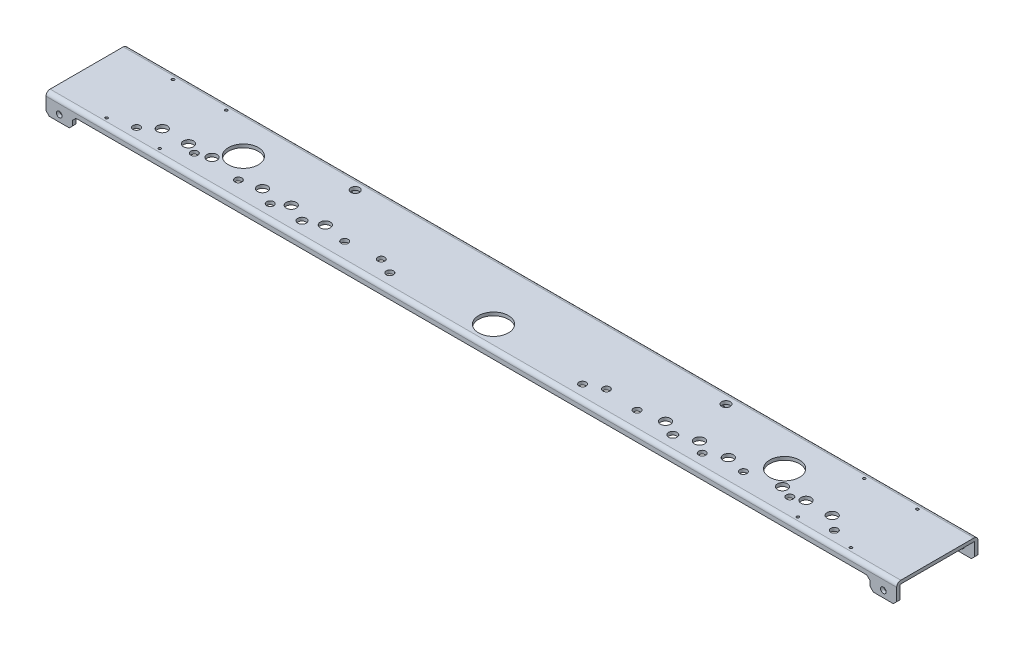
from build123d import *

# Parameters (mm, degrees)
SKETCH1_W                 = 812.8
SKETCH1_H                 = 77.724
BOSS_EXTRUDE1_DEPTH       = 19.05
SKETCH2_W                 = 71.374
SKETCH2_H                 = 15.875
CUT_EXTRUDE1_DEPTH        = 817.296745672
CUT_EXTRUDE2_REACH        = 818.662
SKETCH3_W                 = 762
SKETCH3_H                 = 11.1125
M8_CLEARANCE_HOLE1_D      = 9.652
M8_CLEARANCE_HOLE1_DEPTH  = 19.05
M2_CLEARANCE_HOLE1_D      = 2.54
M2_CLEARANCE_HOLE1_DEPTH  = 19.05
M25_CLEARANCE_HOLE1_D     = 28.575
M25_CLEARANCE_HOLE1_DEPTH = 19.05
M6_CLEARANCE_HOLE1_D      = 6.7564
M6_CLEARANCE_HOLE1_DEPTH  = 19.05
HOLE1_D                   = 8.128
HOLE1_DEPTH               = 19.05
M5_CLEARANCE_HOLE1_D      = 5.334
M5_CLEARANCE_HOLE1_DEPTH  = 3.175
M5_CLEARANCE_HOLE2_D      = 5.334
M5_CLEARANCE_HOLE2_DEPTH  = 77.724
CHAMFER1_SIZE             = 3.175
FILLET1_R                 = 0.762
FILLET2_R                 = 3.937


with BuildPart() as part:
    # Sketch1 → Boss-Extrude1 (new body)
    with BuildSketch(Plane.XZ.offset(15.875)):
        with Locations((406.4, -34.925)):
            Rectangle(SKETCH1_W, SKETCH1_H)
    extrude(amount=-BOSS_EXTRUDE1_DEPTH)

    # Sketch2 → Cut-Extrude1 (cut, through all)
    with BuildSketch(Plane.ZY):
        with Locations((-34.925, -7.9375)):
            Rectangle(SKETCH2_W, SKETCH2_H)
    extrude(amount=-CUT_EXTRUDE1_DEPTH, mode=Mode.SUBTRACT)

    # Sketch3 → Cut-Extrude2 (cut, up to next)
    with BuildSketch(Plane.XY.offset(3.937), mode=Mode.PRIVATE) as cut_extrude2_sk1:
        with Locations((406.4, -10.31875)):
            Rectangle(SKETCH3_W, SKETCH3_H)
    cut_extrude2_tool1 = extrude(cut_extrude2_sk1.sketch, amount=-CUT_EXTRUDE2_REACH, mode=Mode.PRIVATE) & part.part
    add(cut_extrude2_tool1.solids().sort_by_distance((406.4, -10.31875, 3.937))[0], mode=Mode.SUBTRACT)

    # M8 Clearance Hole1
    with Locations(Plane(origin=(0, 3.175, 0), x_dir=(1, 0, 0), z_dir=(0, 1, 0))):
        with Locations((568.924874752, 19.05), (601.438495912, 19.05), (628.947697627, 19.05), (243.875125248, 19.05), (211.361504088, 19.05), (183.852302373, 19.05), (678.944202666, 20.828), (701.450372003, 20.828), (726.460886343, 20.828), (133.855797334, 20.828), (111.349627997, 20.828), (86.339113657, 20.828)):
            Hole(M8_CLEARANCE_HOLE1_D / 2, depth=M8_CLEARANCE_HOLE1_DEPTH)

    # M2 Clearance Hole1
    with Locations(Plane(origin=(0, 3.175, 0), x_dir=(1, 0, 0), z_dir=(0, 1, 0))):
        with Locations((711.2, 3.175), (711.2, 66.675), (762, 3.175), (762, 66.675), (101.6, 3.175), (50.8, 3.175), (101.6, 66.675), (50.8, 66.675)):
            Hole(M2_CLEARANCE_HOLE1_D / 2, depth=M2_CLEARANCE_HOLE1_DEPTH)

    # M25 Clearance Hole1
    with Locations(Plane(origin=(0, 3.175, 0), x_dir=(1, 0, 0), z_dir=(0, 1, 0))):
        with Locations((664.970837168, 36.83), (147.829162832, 36.83), (406.4, 17.272)):
            Hole(M25_CLEARANCE_HOLE1_D / 2, depth=M25_CLEARANCE_HOLE1_DEPTH)

    # M6 Clearance Hole1
    with Locations(Plane(origin=(0, 3.175, 0), x_dir=(1, 0, 0), z_dir=(0, 1, 0))):
        with Locations((612.775, 10.287), (498.475, 10.287), (314.325, 10.287), (200.025, 10.287), (739.775, 9.525), (690.88, 15.875), (121.92, 15.875), (73.025, 9.525), (647.7, 14.732), (546.1, 14.732), (165.1, 14.732), (266.7, 14.732), (513.925467617, 17.547282407), (298.874532383, 17.547282407)):
            Hole(M6_CLEARANCE_HOLE1_D / 2, depth=M6_CLEARANCE_HOLE1_DEPTH)

    # Hole1
    with Locations(Plane(origin=(0, 3.175, 0), x_dir=(1, 0, 0), z_dir=(0, 1, 0))):
        with Locations((583.538437168, 62.23), (583.538437168, 11.43), (229.261562832, 11.43), (229.261562832, 62.23)):
            Hole(HOLE1_D / 2, depth=HOLE1_DEPTH)

    # M5 Clearance Hole1
    with Locations(Plane(origin=(0, 0, 0.762), x_dir=(-1, 0, 0), z_dir=(0, 0, -1))):
        with Locations((-12.7, -9.525), (-800.1, -9.525)):
            Hole(M5_CLEARANCE_HOLE1_D / 2, depth=M5_CLEARANCE_HOLE1_DEPTH)

    # M5 Clearance Hole2
    with Locations(Plane(origin=(0, 0, -73.787), x_dir=(-1, 0, 0), z_dir=(0, 0, -1))):
        with Locations((-800.1, -9.525), (-774.7, -9.525), (-749.3, -9.525), (-723.9, -9.525), (-698.5, -9.525), (-673.1, -9.525), (-647.7, -9.525), (-622.3, -9.525), (-596.9, -9.525), (-571.5, -9.525), (-546.1, -9.525), (-520.7, -9.525), (-495.3, -9.525), (-469.9, -9.525), (-444.5, -9.525), (-419.1, -9.525), (-393.7, -9.525), (-368.3, -9.525), (-342.9, -9.525), (-317.5, -9.525), (-292.1, -9.525), (-266.7, -9.525), (-241.3, -9.525), (-215.9, -9.525), (-190.5, -9.525), (-165.1, -9.525), (-139.7, -9.525), (-114.3, -9.525), (-88.9, -9.525), (-63.5, -9.525), (-38.1, -9.525), (-12.7, -9.525)):
            Hole(M5_CLEARANCE_HOLE2_D / 2, depth=M5_CLEARANCE_HOLE2_DEPTH)

    # Chamfer1
    chamfer1_edges = [part.edges().sort_by_distance(p)[0] for p in [
        (812.8, -15.875, 2.3495),
        (0, -15.875, -72.1995),
        (787.4, -4.7625, 2.3495),
        (25.4, -4.7625, 2.3495),
        (25.4, -15.875, 2.3495),
        (787.4, -15.875, 2.3495),
        (0, -15.875, 2.3495),
        (812.8, -15.875, -72.1995),
    ]]
    chamfer(chamfer1_edges, length=CHAMFER1_SIZE)

    # Fillet1
    fillet1_edges = [part.edges().sort_by_distance(p)[0] for p in [
        (406.4, 0, -70.612),
        (406.4, 0, 0.762),
    ]]
    fillet(fillet1_edges, radius=FILLET1_R)

    # Fillet2
    fillet2_edges = [part.edges().sort_by_distance(p)[0] for p in [
        (406.4, 3.175, -73.787),
        (406.4, 3.175, 3.937),
    ]]
    fillet(fillet2_edges, radius=FILLET2_R)


solid = part.part
